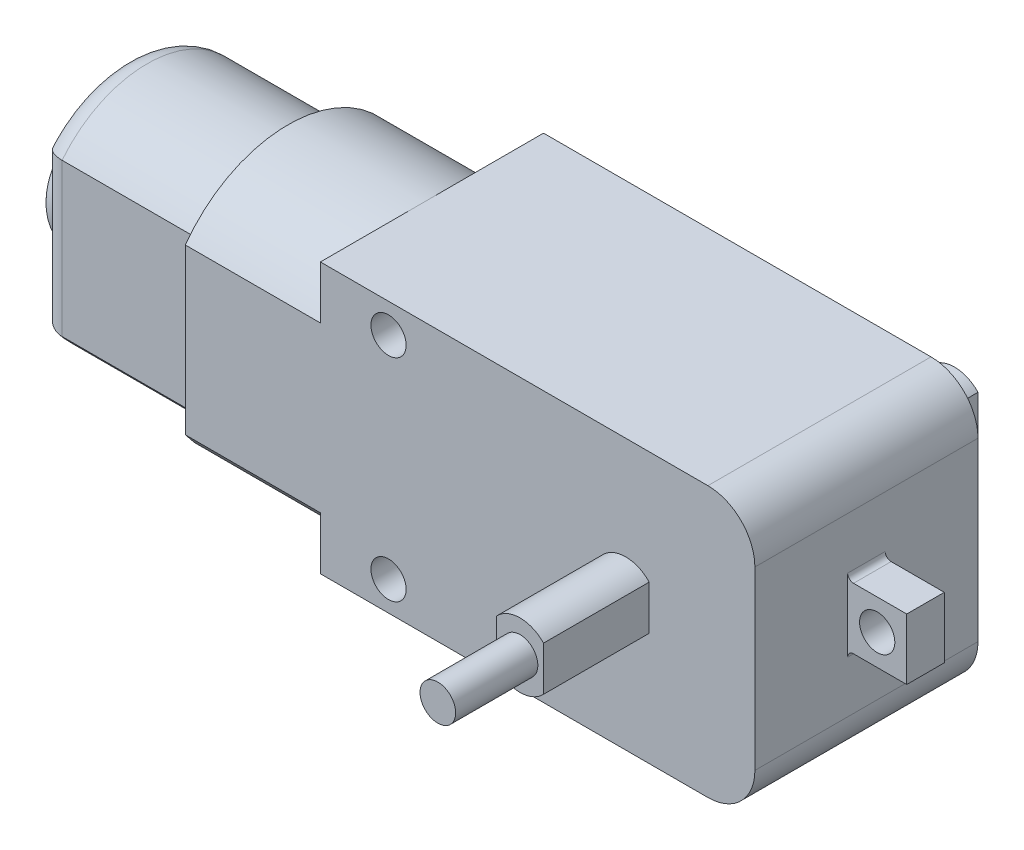
from build123d import *

# Parameters (mm, degrees)
ESBO_O1_W                     = 19
ESBO_O1_H                     = 23
RESSALTO_EXTRUS_O1_DEPTH      = 37
FILETE3_R                     = 4
ESBO_O2_W                     = 3.2
ESBO_O2_H                     = 5.2
RESSALTO_EXTRUS_O2_DEPTH      = 5.030814575
ESBO_O4_R                     = 1.5
CORTE_EXTRUS_O1_DEPTH         = 45.967203313
FILETE4_R                     = 0.5
FILETE5_R                     = 0.5
RESSALTO_EXTRUS_O6_DEPTH      = 9
RESSALTO_EXTRUS_O6_DEPTH_BACK = 28
ESBO_O10_R                    = 2
RESSALTO_EXTRUS_O7_DEPTH      = 2
RESSALTO_EXTRUS_O8_DEPTH      = 11.5
RESSALTO_EXTRUS_O9_DEPTH      = 14
FILETE6_R                     = 2
ESBO_O13_R                    = 5
ESBO_O13_R_2                  = 1
RESSALTO_EXTRUS_O12_DEPTH     = 2.5
FILETE7_R                     = 1.5
ESBO_O14_R                    = 1.5
CORTE_EXTRUS_O2_DEPTH         = 52.796132807
ESBO_O16_R                    = 1.516823529
RESSALTO_EXTRUS_O14_DEPTH     = 7


with BuildPart() as part:
    # Esboço1 → Ressalto-extrusão1 (new body)
    with BuildSketch(Plane(origin=(0, 0, 0), x_dir=(0, 0, -1), z_dir=(1, 0, 0))):
        Rectangle(ESBO_O1_W, ESBO_O1_H)
    extrude(amount=RESSALTO_EXTRUS_O1_DEPTH)

    # Filete3
    filete3_edges = [part.edges().sort_by_distance(p)[0] for p in [
        (37, -11.5, 0),
        (37, 11.5, 0),
    ]]
    fillet(filete3_edges, radius=FILETE3_R)

    # Esboço2 → Ressalto-extrusão2 (add)
    with BuildSketch(Plane(origin=(37, 0, 0), x_dir=(0, 0, -1), z_dir=(1, 0, 0))):
        Rectangle(ESBO_O2_W, ESBO_O2_H)
    extrude(amount=RESSALTO_EXTRUS_O2_DEPTH)

    # Esboço4 → Corte-extrusão1 (cut, through all)
    with BuildSketch(Plane(origin=(0, 0, -1.6), x_dir=(-1, 0, 0), z_dir=(0, 0, -1))):
        with Locations((-39.515407287, 0)):
            Circle(ESBO_O4_R)
    extrude(amount=-CORTE_EXTRUS_O1_DEPTH, mode=Mode.SUBTRACT)

    # Filete4
    filete4_edges = [part.edges().sort_by_distance(p)[0] for p in [
        (37, 2.6, 0),
    ]]
    fillet(filete4_edges, radius=FILETE4_R)

    # Filete5
    filete5_edges = [part.edges().sort_by_distance(p)[0] for p in [
        (37, -2.6, 0),
    ]]
    fillet(filete5_edges, radius=FILETE5_R)

    # Esboço6 → Ressalto-extrusão6 (add, two sides: drawn at the far end of the back side and taken through both)
    with BuildSketch(Plane(origin=(0, 0, -9.5), x_dir=(-1, 0, 0), z_dir=(0, 0, -1)).offset(-RESSALTO_EXTRUS_O6_DEPTH_BACK)):
        with BuildLine():
            Line((-28, -1.887458609), (-28, 1.887458609))
            ThreePointArc((-28, 1.887458609), (-26, 2.75), (-24, 1.887458609))
            Line((-24, 1.887458609), (-24, -1.887458609))
            ThreePointArc((-24, -1.887458609), (-26, -2.75), (-28, -1.887458609))
        make_face()
    extrude(amount=RESSALTO_EXTRUS_O6_DEPTH + RESSALTO_EXTRUS_O6_DEPTH_BACK)

    # Esboço10 → Ressalto-extrusão7 (add)
    with BuildSketch(Plane(origin=(0, 0, -9.5), x_dir=(-1, 0, 0), z_dir=(0, 0, -1))):
        with Locations(Location((-14, 0, 0), (0, 0, 180))):
            Circle(ESBO_O10_R)
    extrude(amount=RESSALTO_EXTRUS_O7_DEPTH)

    # Esboço11 → Ressalto-extrusão8 (add)
    with BuildSketch(Plane.ZY):
        with BuildLine():
            Line((9.5, -7), (9.5, 7))
            ThreePointArc((9.5, 7), (0.75, 11.5), (-8, 7))
            Line((-8, 7), (-8, -7))
            ThreePointArc((-8, -7), (0.75, -11.5), (9.5, -7))
        make_face()
    extrude(amount=RESSALTO_EXTRUS_O8_DEPTH)

    # Esboço12 → Ressalto-extrusão9 (add)
    with BuildSketch(Plane.ZY.offset(11.5)):
        with BuildLine():
            Line((-6.5, 6.498793601), (-6.5, -6.498793601))
            ThreePointArc((-6.5, -6.498793601), (0.75, -10), (8, -6.498793601))
            Line((8, -6.498793601), (8, 6.498793601))
            ThreePointArc((8, 6.498793601), (0.75, 10), (-6.5, 6.498793601))
        make_face()
    extrude(amount=RESSALTO_EXTRUS_O9_DEPTH)

    # Filete6
    filete6_edges = [part.edges().sort_by_distance(p)[0] for p in [
        (-25.5, 10, 0.75),
        (-25.5, 0, -6.5),
        (-25.5, -10, 0.75),
        (-25.5, 0, 8),
    ]]
    fillet(filete6_edges, radius=FILETE6_R)

    # Esboço13 → Ressalto-extrusão12 (add)
    with BuildSketch(Plane.ZY.offset(25.5)):
        with Locations((0.75, 0)):
            Circle(ESBO_O13_R)
        with Locations((0.75, 0)):
            Circle(ESBO_O13_R_2, mode=Mode.SUBTRACT)
    extrude(amount=RESSALTO_EXTRUS_O12_DEPTH)

    # Filete7
    filete7_edges = [part.edges().sort_by_distance(p)[0] for p in [
        (-28, 0, -4.25),
    ]]
    fillet(filete7_edges, radius=FILETE7_R)

    # Esboço14 → Corte-extrusão2 (cut, through all)
    with BuildSketch(Plane(origin=(0, 0, -9.5), x_dir=(-1, 0, 0), z_dir=(0, 0, -1))):
        with Locations((-5.8, 9)):
            Circle(ESBO_O14_R)
        with Locations((-5.8, -9)):
            Circle(ESBO_O14_R)
    extrude(amount=-CORTE_EXTRUS_O2_DEPTH, mode=Mode.SUBTRACT)

    # Esboço16 → Ressalto-extrusão14 (add)
    with BuildSketch(Plane.XY.offset(18.5)):
        with Locations(Location((26, 0, 0), (0, 0, 180))):
            Circle(ESBO_O16_R)
    extrude(amount=RESSALTO_EXTRUS_O14_DEPTH)


solid = part.part
